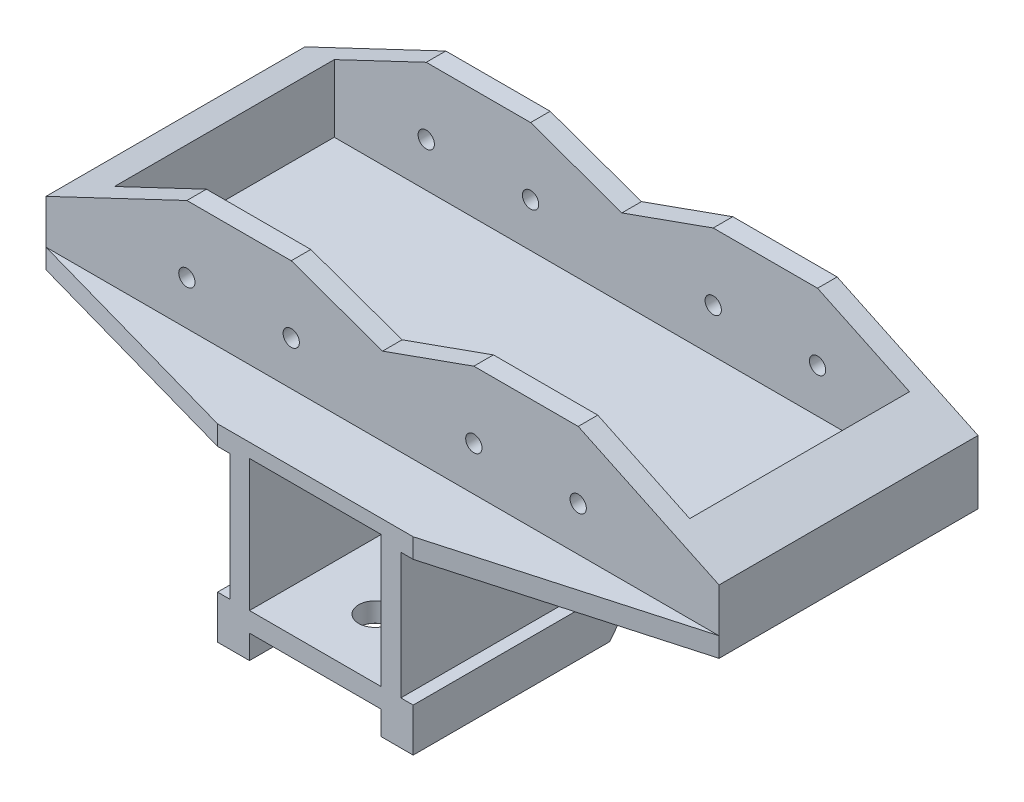
from build123d import *

# Parameters (mm, degrees)
SKETCH_1_W            = 103.2
SKETCH_1_H            = 20
EXTRUDE_1_DEPTH       = 39.7
SKETCH_2_W            = 88.2
SKETCH_2_H            = 33.7
CUT_EXTRUDE_1_DEPTH   = 17
EXTRUDE_START         = -3
SKETCH_3_W            = 30
SKETCH_3_H            = 50
EXTRUDE_2_DEPTH       = 29
SKETCH_21_W           = 20.2
SKETCH_21_H           = 20.2
CUT_EXTRUDE_11_DEPTH  = 30.15
SKETCH_22_W           = 20.2
SKETCH_22_H           = 50
CUT_EXTRUDE_12_DEPTH  = 3.65
CUT_EXTRUDE_14_DEPTH  = 88.244254825
EXTRUDE_4_DEPTH       = 3
F_2_5MM_2_D           = 2.5
F_2_5MM_2_CSINK_D     = 2.55
F_2_5MM_2_CSINK_ANGLE = 90
F_5_0MM_3_D           = 5
F_5_0MM_3_DEPTH       = 3
F_5_0MM_3_CSINK_D     = 5.05
F_5_0MM_3_CSINK_ANGLE = 90
SKETCH_30_W           = 52.520858891
SKETCH_30_H           = 19.35
CUT_EXTRUDE_15_DEPTH  = 1.9
CUT_EXTRUDE_16_DEPTH  = 1.9
F_5_0MM_4_D           = 5
F_5_0MM_4_CSINK_D     = 5.05
F_5_0MM_4_CSINK_ANGLE = 90
CUT_EXTRUDE_19_DEPTH  = 118.585033061
F_2_5MM_1_D           = 2.5
F_2_5MM_1_CSINK_D     = 2.55
F_2_5MM_1_CSINK_ANGLE = 90


with BuildPart() as part:
    # 草图1 → 凸台-拉伸1 (new body)
    with BuildSketch(Plane.XY):
        with Locations((-51.6, 10)):
            Rectangle(SKETCH_1_W, SKETCH_1_H)
    extrude(amount=EXTRUDE_1_DEPTH)

    # 草图2 → 切除-拉伸1 (cut)
    with BuildSketch(Plane(origin=(0, 20, 0), x_dir=(1, 0, 0), z_dir=(0, 1, 0))):
        with Locations((-51.6, -19.85)):
            Rectangle(SKETCH_2_W, SKETCH_2_H)
    extrude(amount=-CUT_EXTRUDE_1_DEPTH, mode=Mode.SUBTRACT)

    # 草图3 → 凸台-拉伸2 (add)
    with BuildSketch(Plane.XZ.offset(EXTRUDE_START)):
        with Locations((-51.6, 25)):
            Rectangle(SKETCH_3_W, SKETCH_3_H)
    extrude(amount=EXTRUDE_2_DEPTH)

    # 草图21 → 切除-拉伸11 (cut)
    with BuildSketch(Plane.XY.offset(50)):
        with Locations((-51.6, -9.25)):
            Rectangle(SKETCH_21_W, SKETCH_21_H)
    extrude(amount=-CUT_EXTRUDE_11_DEPTH, mode=Mode.SUBTRACT)

    # 草图22 → 切除-拉伸12 (cut)
    with BuildSketch(Plane.XZ.offset(26)):
        with Locations((-51.6, 25)):
            Rectangle(SKETCH_22_W, SKETCH_22_H)
    extrude(amount=-CUT_EXTRUDE_12_DEPTH, mode=Mode.SUBTRACT)

    # 草图24 → 切除-拉伸14 (cut, through all)
    with BuildSketch(Plane(origin=(-36.6, 0, 0), x_dir=(0, 0, -1), z_dir=(1, 0, 0))):
        Polygon((0, 0), (0, -26), (-19.85, -26), align=None)
    extrude(amount=-CUT_EXTRUDE_14_DEPTH, mode=Mode.SUBTRACT)

    # 草图25 → 凸台-拉伸4 (add)
    with BuildSketch(Plane.XZ):
        Polygon((-36.6, 39.7), (-36.6, 50), (0, 39.7), align=None)
        Polygon((-66.6, 39.7), (-103.2, 39.7), (-66.6, 50), align=None)
    extrude(amount=-EXTRUDE_4_DEPTH)

    # Ø2.5mm 暗销孔2 (through all)
    with Locations(Plane(origin=(0, 0, 0), x_dir=(-1, 0, 0), z_dir=(0, 0, -1))):
        with Locations((81.6, 9.75), (37.6, 9.75), (21.6, 9.75), (65.6, 9.75)):
            CounterSinkHole(F_2_5MM_2_D / 2, F_2_5MM_2_CSINK_D / 2, counter_sink_angle=F_2_5MM_2_CSINK_ANGLE)

    # Ø5.0mm 暗销孔3
    with Locations(Plane(origin=(0, -22.35, 0), x_dir=(-1, 0, 0), z_dir=(0, -1, 0))):
        with Locations((51.6, -40.85), (51.6, -25.85)):
            CounterSinkHole(F_5_0MM_3_D / 2, F_5_0MM_3_CSINK_D / 2, depth=F_5_0MM_3_DEPTH, counter_sink_angle=F_5_0MM_3_CSINK_ANGLE)

    # 草图30 → 切除-拉伸15 (cut)
    with BuildSketch(Plane(origin=(-36.6, 0, 0), x_dir=(0, 0, -1), z_dir=(1, 0, 0))):
        with Locations((-23.739570554, -9.675)):
            Rectangle(SKETCH_30_W, SKETCH_30_H)
    extrude(amount=-CUT_EXTRUDE_15_DEPTH, mode=Mode.SUBTRACT)

    # 草图31 → 切除-拉伸16 (cut)
    with BuildSketch(Plane.ZY.offset(66.6)):
        Polygon((0, 0), (14.772980769, -19.35), (50, -19.35), (50, 0), align=None)
    extrude(amount=-CUT_EXTRUDE_16_DEPTH, mode=Mode.SUBTRACT)

    # Ø5.0mm 暗销孔4 (through all)
    with Locations(Plane(origin=(-38.5, 0, 0), x_dir=(0, 0, -1), z_dir=(1, 0, 0))):
        with Locations((-25.85, -9.25)):
            CounterSinkHole(F_5_0MM_4_D / 2, F_5_0MM_4_CSINK_D / 2, counter_sink_angle=F_5_0MM_4_CSINK_ANGLE)

    # 草图35 → 切除-拉伸19 (cut, through all)
    with BuildSketch(Plane(origin=(0, 0, 0), x_dir=(-1, 0, 0), z_dir=(0, 0, -1))):
        Polygon((103.2, 20), (81.6, 20), (103.2, 9.75), align=None)
        Polygon((0, 20), (0, 9.75), (21.6, 20), align=None)
        Polygon((65.6, 20), (51.6, 15), (37.6, 20), align=None)
    extrude(amount=-CUT_EXTRUDE_19_DEPTH, mode=Mode.SUBTRACT)

    # Ø2.5mm 暗销孔1 (through all)
    with Locations(Plane(origin=(0, 0, 0), x_dir=(-1, 0, 0), z_dir=(0, 0, -1))):
        with Locations((81.6, 9.75), (37.6, 9.75), (21.6, 9.75), (65.6, 9.75)):
            CounterSinkHole(F_2_5MM_1_D / 2, F_2_5MM_1_CSINK_D / 2, counter_sink_angle=F_2_5MM_1_CSINK_ANGLE)


solid = part.part
